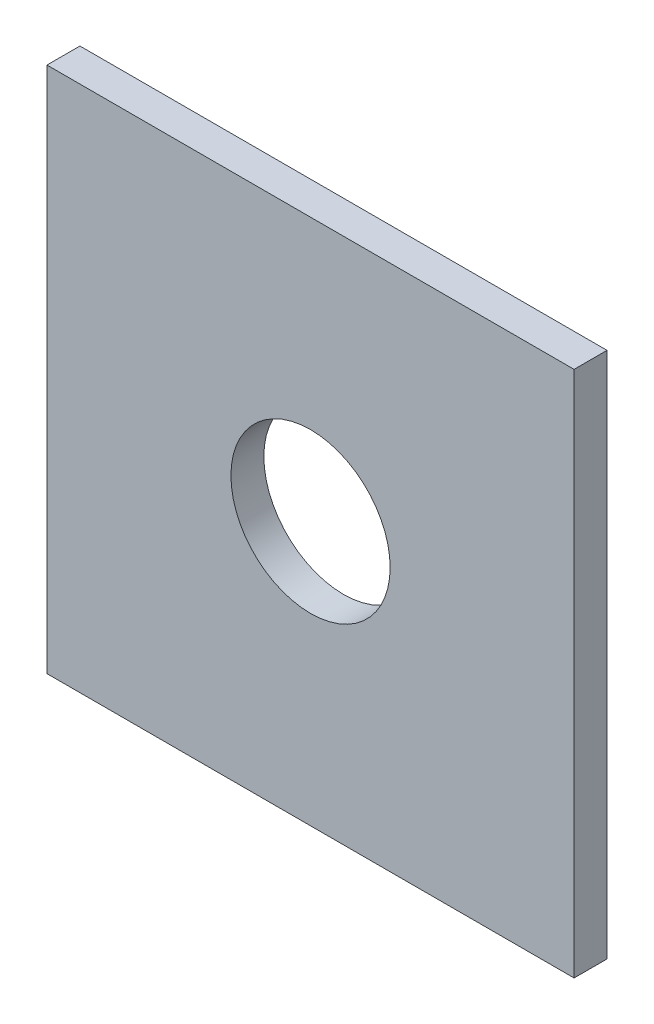
from build123d import *

# Parameters (mm, degrees)
SKETCH1_W           = 304.8
SKETCH1_H           = 304.8
SKETCH1_R           = 46.0375
BOSS_EXTRUDE1_DEPTH = 19.05
SKETCH2_R           = 7.9375
CUT_EXTRUDE1_DEPTH  = 15.875


with BuildPart() as part:
    # Sketch1 → Boss-Extrude1 (new body)
    with BuildSketch(Plane.XY):
        Rectangle(SKETCH1_W, SKETCH1_H)
        with Locations(Location((0, 0, 0), (0, 0, 180))):
            Circle(SKETCH1_R, mode=Mode.SUBTRACT)
    extrude(amount=BOSS_EXTRUDE1_DEPTH)

    # Sketch2 → Cut-Extrude1 (cut)
    with BuildSketch(Plane.XY):
        with Locations(Location((-71.842048969, 71.842048969, 0), (0, 0, 180))):
            Circle(SKETCH2_R)
        with Locations(Location((71.842048969, -71.842048969, 0), (0, 0, 180))):
            Circle(SKETCH2_R)
    extrude(amount=CUT_EXTRUDE1_DEPTH, mode=Mode.SUBTRACT)


solid = part.part
